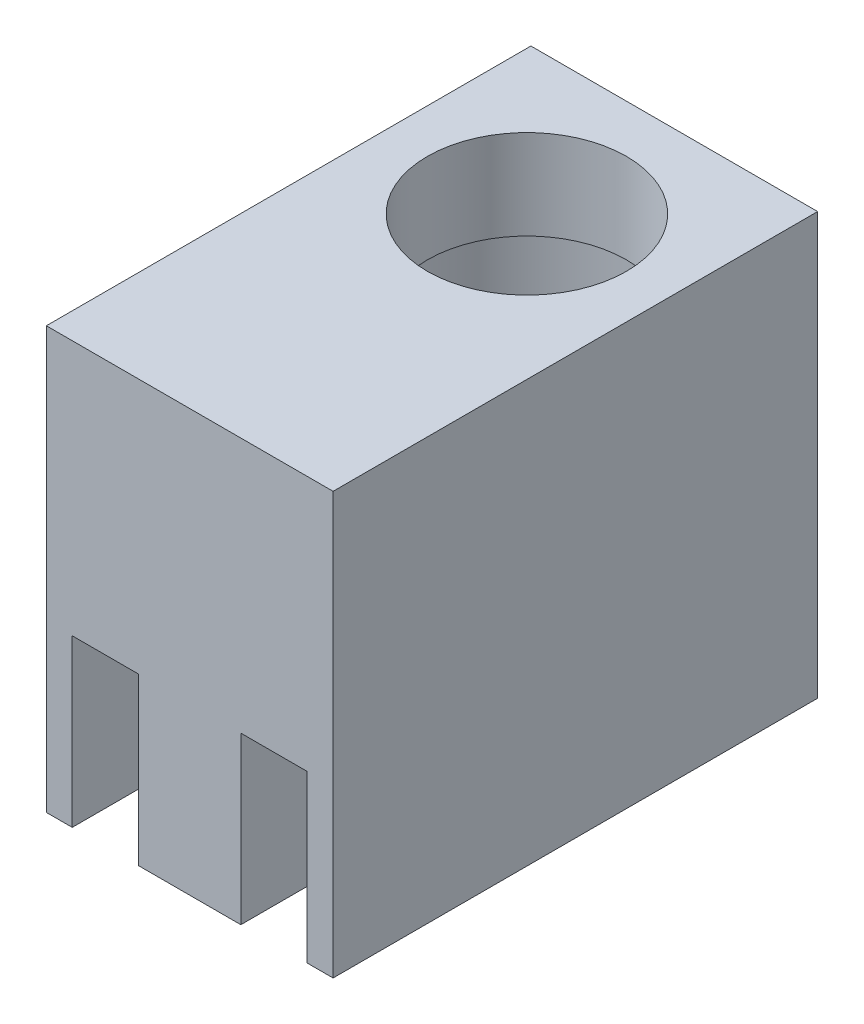
from build123d import *

# Parameters (mm, degrees)
SKETCH_1_W          = 4.32
SKETCH_1_H          = 7.3
SKETCH_1_R          = 1.5
EXTRUDE_2_DEPTH     = 6.35
SKETCH_1_4_R        = 2
SKETCH_1_4_R_2      = 1.5
CUT_EXTRUDE_1_DEPTH = 5
SKETCH_2_W          = 1
SKETCH_2_H          = 4.148817955
CUT_EXTRUDE_2_DEPTH = 2.5


with BuildPart() as part:
    # Эскиз1 → Бобышка-Вытянуть2 (new body)
    with BuildSketch(Plane(origin=(0, 0, 0), x_dir=(1, 0, 0), z_dir=(0, 1, 0))):
        Rectangle(SKETCH_1_W, SKETCH_1_H)
        with Locations((0, 1.43)):
            Circle(SKETCH_1_R, mode=Mode.SUBTRACT)
    extrude(amount=EXTRUDE_2_DEPTH)

    # Эскиз1<4> → Вырез-Вытянуть1 (cut)
    with BuildSketch(Plane(origin=(0, 0, 0), x_dir=(1, 0, 0), z_dir=(0, 1, 0))):
        with Locations((0, 1.43)):
            Circle(SKETCH_1_4_R)
        with Locations((0, 1.43)):
            Circle(SKETCH_1_4_R_2, mode=Mode.SUBTRACT)
    extrude(amount=CUT_EXTRUDE_1_DEPTH, mode=Mode.SUBTRACT)

    # Эскиз2 → Вырез-Вытянуть2 (cut)
    with BuildSketch(Plane.XZ):
        with Locations((-1.27, 1.575591023)):
            Rectangle(SKETCH_2_W, SKETCH_2_H)
        with Locations((1.27, 1.575591023)):
            Rectangle(SKETCH_2_W, SKETCH_2_H)
    extrude(amount=-CUT_EXTRUDE_2_DEPTH, mode=Mode.SUBTRACT)


solid = part.part
